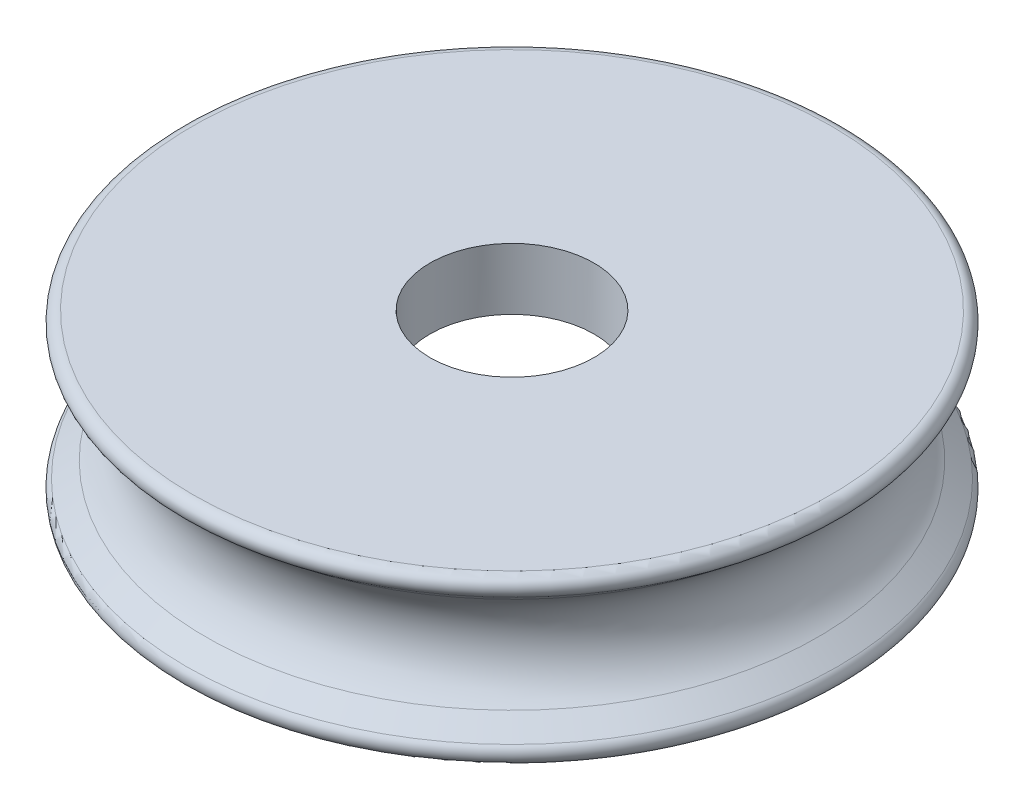
from build123d import *

# Parameters (mm, degrees)
SKETCH_1_R          = 17
EXTRUDE_1_DEPTH     = 8
SKETCH_2_R          = 12
CUT_EXTRUDE_2_DEPTH = 5
FILLET_1_R          = 0.5
SKETCH_5_R          = 4
CUT_EXTRUDE_3_DEPTH = 25.099505092


with BuildPart() as part:
    # Эскиз1 → Вытянуть1 (new body)
    with BuildSketch(Plane(origin=(0, 0, 0), x_dir=(1, 0, 0), z_dir=(0, 1, 0))):
        with Locations(Location((0, 0, 0), (0, 0, 270))):
            Circle(SKETCH_1_R)
    extrude(amount=EXTRUDE_1_DEPTH)

    # Эскиз2 → Вытянуть2 (cut)
    with BuildSketch(Plane.XZ):
        with Locations(Location((0, 0, 0), (0, 0, 270))):
            Circle(SKETCH_2_R)
    extrude(amount=-CUT_EXTRUDE_2_DEPTH, mode=Mode.SUBTRACT)

    # Эскиз4 → Вырез-Повернуть1 (revolve, cut)
    with BuildSketch(Plane(origin=(0, 0, 0), x_dir=(0, 0, -1), z_dir=(1, 0, 0))):
        with BuildLine():
            Line((17, 8), (14.928258035, 6.342606428))
            ThreePointArc((14.928258035, 6.342606428), (13.802343178, 4), (14.928258035, 1.657393572))
            Line((14.928258035, 1.657393572), (17, 0))
            Line((17, 0), (17, 8))
        make_face()
    revolve(axis=Axis((0, 11, 0), (0, 1, 0)), mode=Mode.SUBTRACT)

    # Скругление1
    fillet_1_edges = [part.edges().sort_by_distance(p)[0] for p in [
        (0, 8, 17),
        (0, 0, 17),
    ]]
    fillet(fillet_1_edges, radius=FILLET_1_R)

    # Эскиз5 → Вытянуть3 (cut, through all)
    with BuildSketch(Plane(origin=(0, 8, 0), x_dir=(1, 0, 0), z_dir=(0, 1, 0))):
        with Locations(Location((0, 0, 0), (0, 0, 270))):
            Circle(SKETCH_5_R)
    extrude(amount=-CUT_EXTRUDE_3_DEPTH, mode=Mode.SUBTRACT)


solid = part.part
